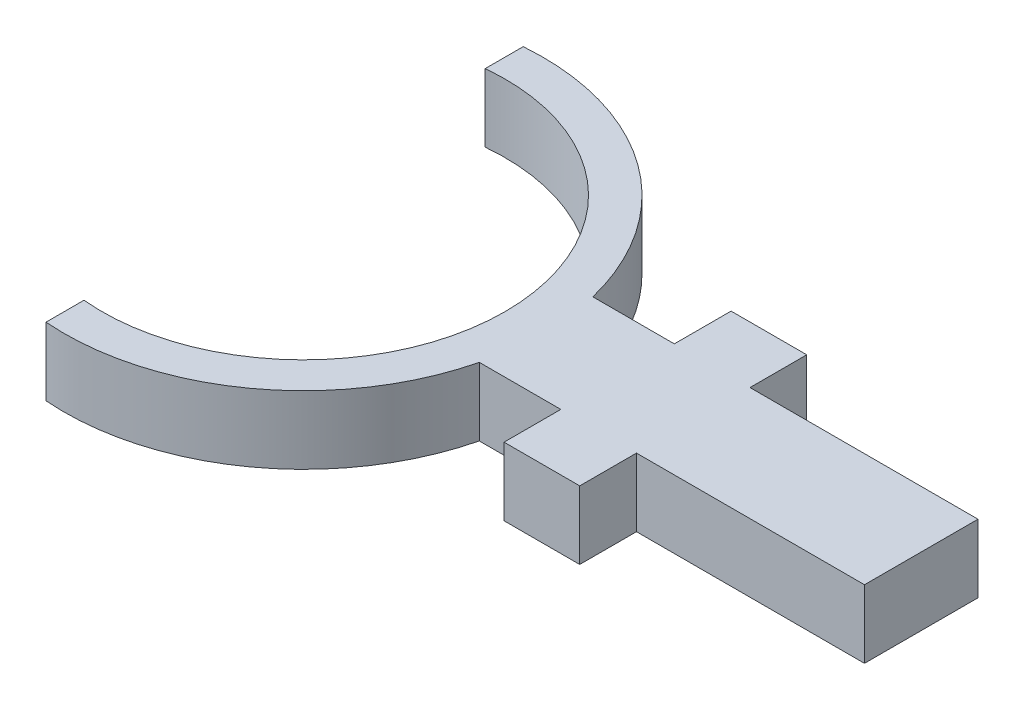
from build123d import *

# Parameters (mm, degrees)
SKETCH_1_R           = 6.326152672
SKETCH_1_R_2         = 5.326152672
EXTRUDE_1_DEPTH      = 1.8
EXTRUDE_2_DEPTH      = 10
EXTRUDE_2_DEPTH_BACK = 0.5
SKETCH_2_W           = 3
SKETCH_2_H           = 1.8
CUT_EXTRUDE_1_REACH  = 19.601
SKETCH_3_W           = 6.461960394
SKETCH_3_H           = 15
EXTRUDE_START        = -1.8
SKETCH_4_W           = 2
SKETCH_4_H           = 6
EXTRUDE_3_DEPTH      = 1.8


with BuildPart() as part:
    # 草图1 → 凸台-拉伸1 (new body)
    with BuildSketch(Plane(origin=(0, 0, 0), x_dir=(1, 0, 0), z_dir=(0, 1, 0))):
        with Locations(Location((0, 0, 0), (0, 0, 270))):
            Circle(SKETCH_1_R)
        with Locations(Location((0, 0, 0), (0, 0, 270))):
            Circle(SKETCH_1_R_2, mode=Mode.SUBTRACT)
    extrude(amount=EXTRUDE_1_DEPTH)

    # 草图2 → 凸台-拉伸2 (add, two sides: drawn at the far end of the back side and taken through both)
    with BuildSketch(Plane(origin=(6.326152672, 0, 0), x_dir=(0, 0, -1), z_dir=(1, 0, 0)).offset(-EXTRUDE_2_DEPTH_BACK)):
        with Locations((0, 0.9)):
            Rectangle(SKETCH_2_W, SKETCH_2_H)
    extrude(amount=EXTRUDE_2_DEPTH + EXTRUDE_2_DEPTH_BACK)

    # 草图3 → 切除-拉伸1 (cut, up to next)
    with BuildSketch(Plane(origin=(0, 1.8, 0), x_dir=(1, 0, 0), z_dir=(0, 1, 0)), mode=Mode.PRIVATE) as cut_extrude_1_sk1:
        with Locations((-3.730980197, 0.039566398)):
            Rectangle(SKETCH_3_W, SKETCH_3_H)
    cut_extrude_1_tool1 = extrude(cut_extrude_1_sk1.sketch, amount=-CUT_EXTRUDE_1_REACH, mode=Mode.PRIVATE) & part.part
    add(cut_extrude_1_tool1.solids().sort_by_distance((-3.73098, 1.8, -0.039566))[0], mode=Mode.SUBTRACT)

    # 草图4 → 凸台-拉伸3 (add)
    with BuildSketch(Plane(origin=(0, 1.8, 0), x_dir=(1, 0, 0), z_dir=(0, 1, 0)).offset(EXTRUDE_START)):
        with Locations((9.3, 0)):
            Rectangle(SKETCH_4_W, SKETCH_4_H)
    extrude(amount=EXTRUDE_3_DEPTH)


solid = part.part
